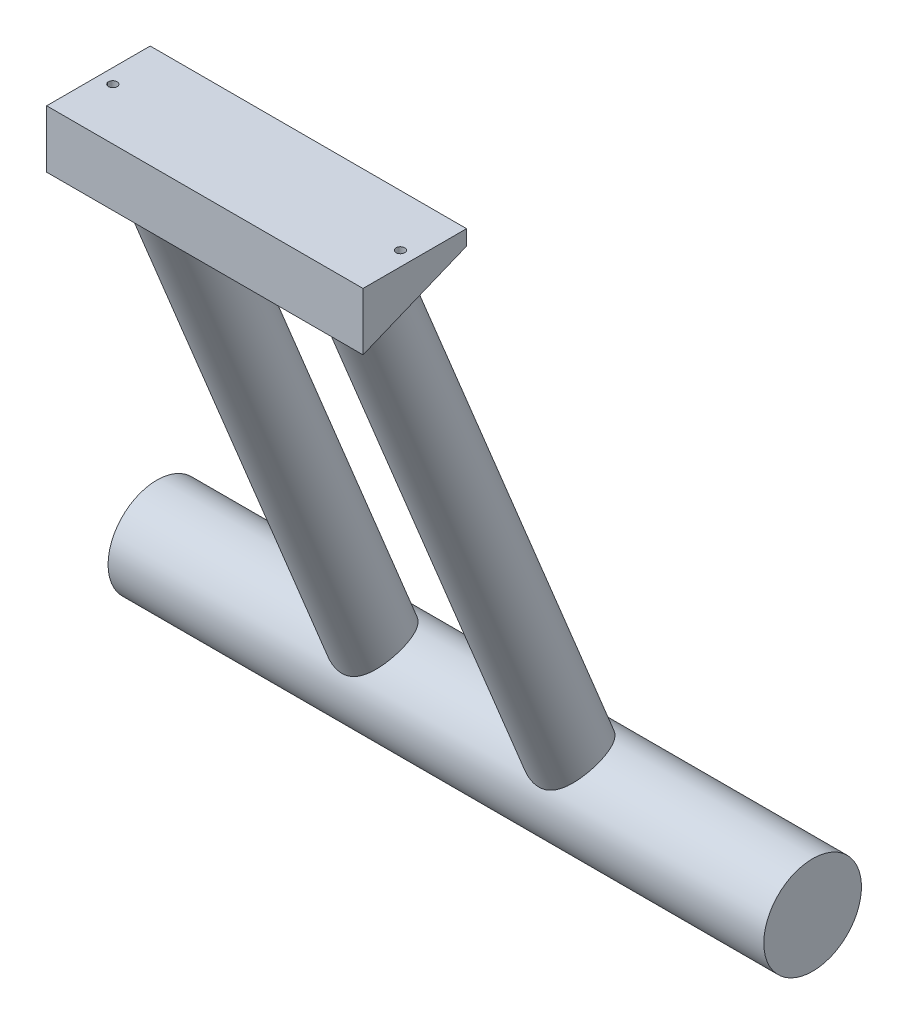
from build123d import *

# Parameters (mm, degrees)
IZIM1_W                          = 55
IZIM1_H                          = 18
Y_KSEKLIK_EKSTR_ZYON1_DEPTH      = 10
KES_EKSTR_ZYON1_DEPTH            = 59.72818744
IZIM3_R                          = 6
Y_KSEKLIK_EKSTR_ZYON2_DEPTH      = 100
IZIM5_W                          = 12
IZIM5_H                          = 12
Y_KSEKLIK_EKSTR_ZYON3_DEPTH      = 12
IZIM7_R                          = 0.75
KES_EKSTR_ZYON3_DEPTH            = 131.929342088
Y_KSEKLIK_EKSTR_ZYON4_DEPTH      = 34
Y_KSEKLIK_EKSTR_ZYON4_DEPTH_BACK = 80
IZIM6_R                          = 8.485281374


with BuildPart() as part:
    # Çizim1 → Yükseklik-Ekstrüzyon1 (new body)
    with BuildSketch(Plane(origin=(0, 0, 0), x_dir=(1, 0, 0), z_dir=(0, 1, 0))):
        with Locations((27.5, -9)):
            Rectangle(IZIM1_W, IZIM1_H)
    extrude(amount=-Y_KSEKLIK_EKSTR_ZYON1_DEPTH)

    # Çizim2 → Kes-Ekstrüzyon1 (cut, through all)
    with BuildSketch(Plane.ZY):
        Polygon((18, -10), (0, -2.63065823), (0, -10), align=None)
    extrude(amount=-KES_EKSTR_ZYON1_DEPTH, mode=Mode.SUBTRACT)

    # Çizim3 → Yükseklik-Ekstrüzyon2 (add)
    with BuildSketch(Plane(origin=(0, -2.253018898, -0.922403682), x_dir=(-1, 0, 0), z_dir=(0, -0.9254441249587121, -0.3788841136540354))):
        with Locations(Location((-10, -10.721774999, 0), (0, 0, 270))):
            Circle(IZIM3_R)
        with Locations(Location((-44.231710038, -10.721774999, 0), (0, 0, 270))):
            Circle(IZIM3_R)
    extrude(amount=Y_KSEKLIK_EKSTR_ZYON2_DEPTH)

    # Çizim5 → Yükseklik-Ekstrüzyon3 (add)
    with BuildSketch(Plane(origin=(0, -94.797431394, -38.810815047), x_dir=(-1, 0, 0), z_dir=(0, -0.9254441249587119, -0.37888411365403546))):
        with Locations((-10, -10.721774999)):
            Rectangle(IZIM5_W, IZIM5_H)
        with Locations((-44.231710038, -10.721774999)):
            Rectangle(IZIM5_W, IZIM5_H)
    extrude(amount=Y_KSEKLIK_EKSTR_ZYON3_DEPTH)

    # Çizim7 → Kes-Ekstrüzyon3 (cut, through all)
    with BuildSketch(Plane(origin=(0, 0, 0), x_dir=(1, 0, 0), z_dir=(0, 1, 0))):
        with Locations(Location((2.5, -9, 0), (0, 0, 270))):
            Circle(IZIM7_R)
        with Locations(Location((52.5, -9, 0), (0, 0, 270))):
            Circle(IZIM7_R)
    extrude(amount=-KES_EKSTR_ZYON3_DEPTH, mode=Mode.SUBTRACT)

    # Çizim6 → Yükseklik-Ekstrüzyon4 (add, two sides: drawn at the far end of the back side and taken through both)
    with BuildSketch(Plane.ZY.offset(-4).offset(-Y_KSEKLIK_EKSTR_ZYON4_DEPTH_BACK)):
        with Locations((-31.161716047, -104.412406361)):
            Circle(IZIM6_R)
    extrude(amount=Y_KSEKLIK_EKSTR_ZYON4_DEPTH + Y_KSEKLIK_EKSTR_ZYON4_DEPTH_BACK)


solid = part.part
